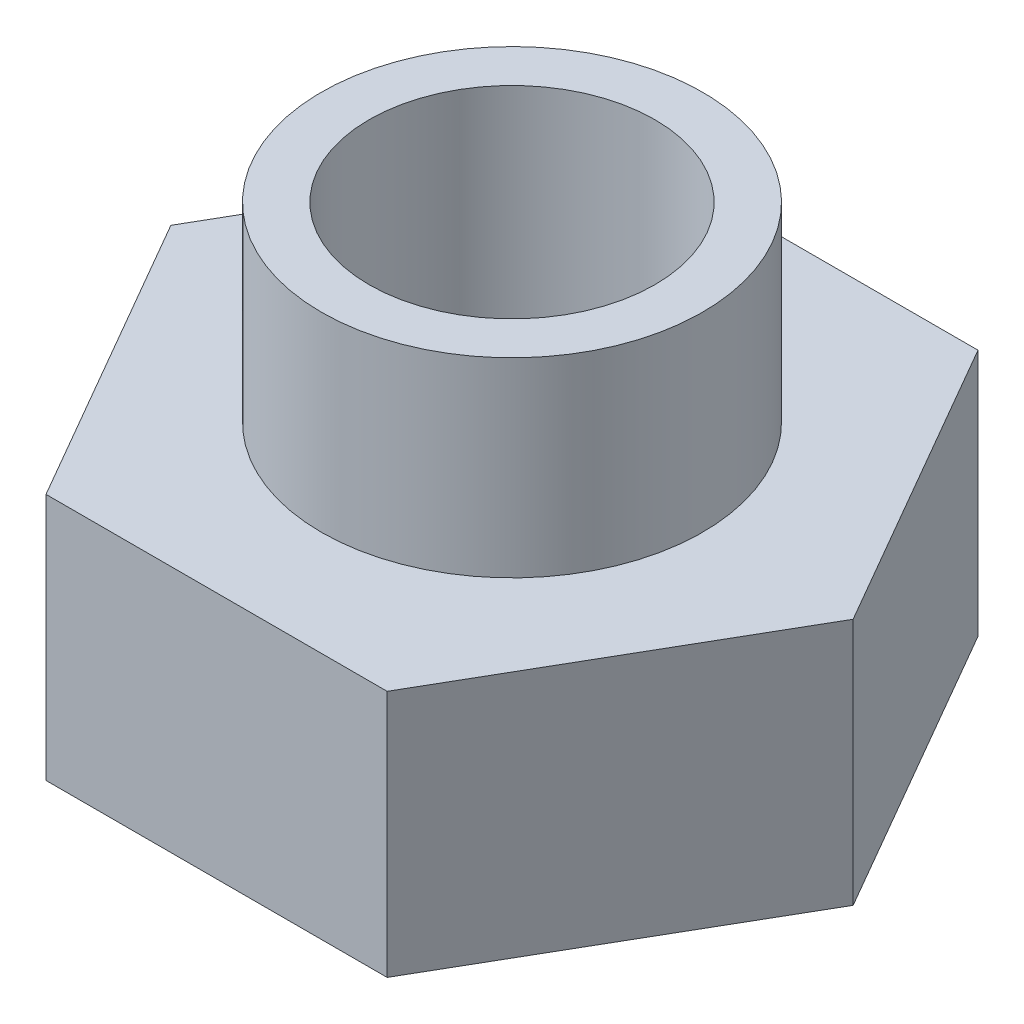
from build123d import *

# Parameters (mm, degrees)
SKETCH1_R           = 50
BOSS_EXTRUDE1_DEPTH = 65
SKETCH1_3_R         = 50
SKETCH1_3_R_2       = 37.5
BOSS_EXTRUDE2_DEPTH = 115


with BuildPart() as part:
    # Sketch1 → Boss-Extrude1 (new body)
    with BuildSketch(Plane(origin=(0, 0, 0), x_dir=(1, 0, 0), z_dir=(0, 1, 0))):
        Polygon((-44.744645862, -77.5), (44.744645862, -77.5), (89.489291724, 0), (44.744645862, 77.5), (-44.744645862, 77.5), (-89.489291724, 0), align=None)
        Circle(SKETCH1_R, mode=Mode.SUBTRACT)
    extrude(amount=BOSS_EXTRUDE1_DEPTH)

    # Sketch1<3> → Boss-Extrude2 (add)
    with BuildSketch(Plane(origin=(0, 0, 0), x_dir=(1, 0, 0), z_dir=(0, 1, 0))):
        Circle(SKETCH1_3_R)
        Circle(SKETCH1_3_R_2, mode=Mode.SUBTRACT)
    extrude(amount=BOSS_EXTRUDE2_DEPTH)


solid = part.part
